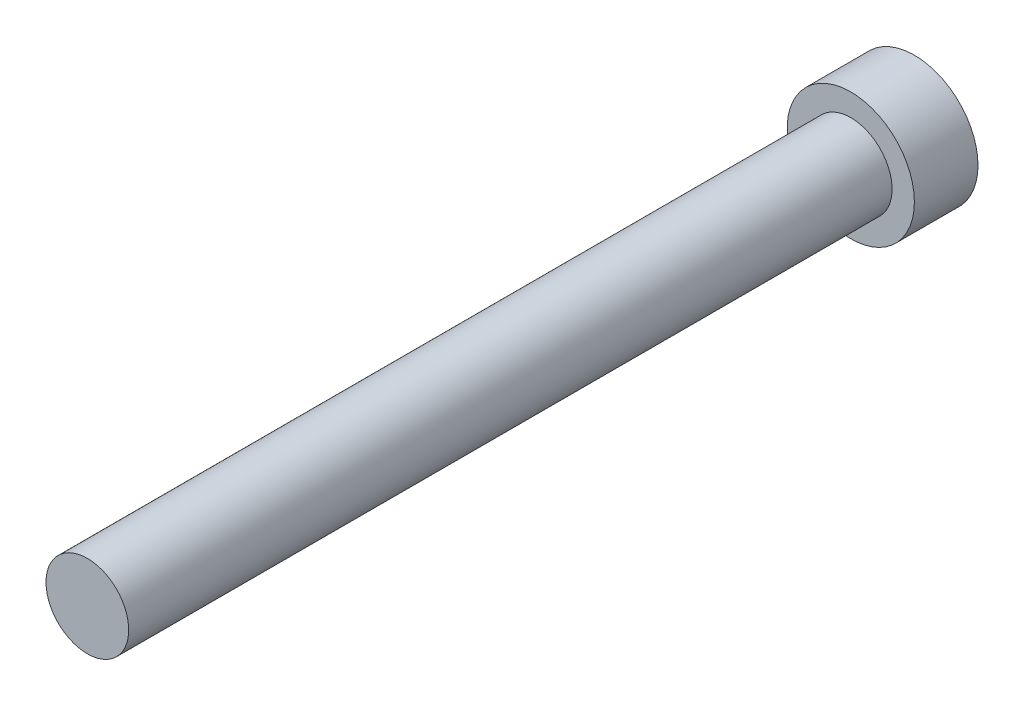
from build123d import *

# Parameters (mm, degrees)
SKETCH1_R           = 2.54
BOSS_EXTRUDE1_DEPTH = 2.54
SKETCH2_R           = 1.651
BOSS_EXTRUDE2_DEPTH = 30.48


with BuildPart() as part:
    # Sketch1 → Boss-Extrude1 (new body)
    with BuildSketch(Plane.XY):
        Circle(SKETCH1_R)
    extrude(amount=BOSS_EXTRUDE1_DEPTH)

    # Sketch2 → Boss-Extrude2 (add)
    with BuildSketch(Plane.XY.offset(2.54)):
        with Locations(Location((0, 0, 0), (0, 0, 180))):
            Circle(SKETCH2_R)
    extrude(amount=BOSS_EXTRUDE2_DEPTH)


solid = part.part
